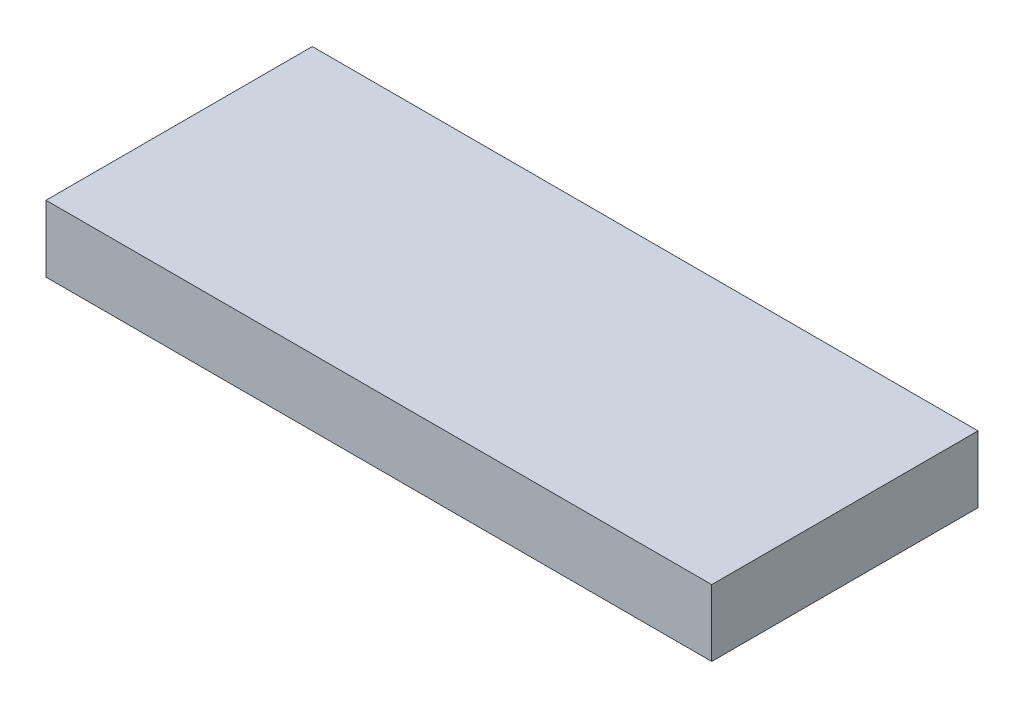
from build123d import *

# Parameters (mm, degrees)
SKETCH1_W           = 63.5
SKETCH1_H           = 25.4
BOSS_EXTRUDE1_DEPTH = 6.35


with BuildPart() as part:
    # Sketch1 → Boss-Extrude1 (new body)
    with BuildSketch(Plane(origin=(0, 0, 0), x_dir=(1, 0, 0), z_dir=(0, 1, 0))):
        with Locations((31.75, -12.7)):
            Rectangle(SKETCH1_W, SKETCH1_H)
    extrude(amount=BOSS_EXTRUDE1_DEPTH)


solid = part.part
